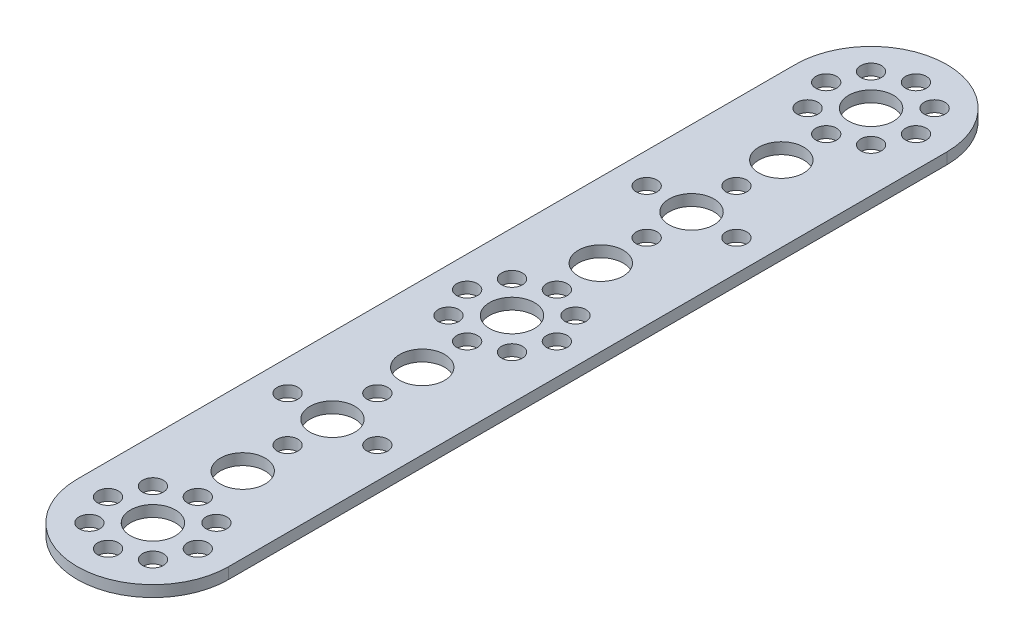
from build123d import *

# Parameters (mm, degrees)
EXTRUDE1_DEPTH = 2
SKETCH2_R      = 4
SKETCH2_R_2    = 1.85
EXTRUDE2_DEPTH = 2


with BuildPart() as part:
    # Sketch1 → Extrude1 (new body)
    with BuildSketch(Plane(origin=(0, 0, 0), x_dir=(1, 0, 0), z_dir=(0, 1, 0))):
        with BuildLine():
            Line((-13.5, 64), (-13.5, -64))
            ThreePointArc((-13.5, -64), (0, -77.5), (13.5, -64))
            Line((13.5, -64), (13.5, 64))
            ThreePointArc((13.5, 64), (0, 77.5), (-13.5, 64))
        make_face()
    extrude(amount=EXTRUDE1_DEPTH)

    # Sketch2 → Extrude2 (cut)
    with BuildSketch(Plane(origin=(0, 2, 0), x_dir=(1, 0, 0), z_dir=(0, 1, 0))):
        with Locations(Location((0, -48, 0), (0, 0, 270))):
            Circle(SKETCH2_R)
        with Locations(Location((0, -16, 0), (0, 0, 270))):
            Circle(SKETCH2_R)
        with Locations(Location((-0.175415159, 16, 0), (0, 0, 270))):
            Circle(SKETCH2_R)
        with Locations(Location((0, 48, 0), (0, 0, 270))):
            Circle(SKETCH2_R)
        with Locations(Location((0, -32, 0), (0, 0, 270))):
            Circle(SKETCH2_R)
        with Locations(Location((0, -24, 0), (0, 0, 270))):
            Circle(SKETCH2_R_2)
        with Locations(Location((0, -40, 0), (0, 0, 270))):
            Circle(SKETCH2_R_2)
        with Locations(Location((8, -32, 0), (0, 0, 270))):
            Circle(SKETCH2_R_2)
        with Locations(Location((-8, -32, 0), (0, 0, 270))):
            Circle(SKETCH2_R_2)
        with Locations(Location((0, -56, 0), (0, 0, 270))):
            Circle(SKETCH2_R_2)
        with Locations(Location((8, -64, 0), (0, 0, 270))):
            Circle(SKETCH2_R_2)
        with Locations(Location((0, -64, 0), (0, 0, 270))):
            Circle(SKETCH2_R)
        with Locations(Location((-8, -64, 0), (0, 0, 270))):
            Circle(SKETCH2_R_2)
        with Locations(Location((-5.66, -69.66, 0), (0, 0, 270))):
            Circle(SKETCH2_R_2)
        with Locations(Location((5.66, -69.66, 0), (0, 0, 270))):
            Circle(SKETCH2_R_2)
        with Locations(Location((0, -72, 0), (0, 0, 270))):
            Circle(SKETCH2_R_2)
        with Locations(Location((-5.66, -58.34, 0), (0, 0, 270))):
            Circle(SKETCH2_R_2)
        with Locations(Location((5.66, -58.34, 0), (0, 0, 270))):
            Circle(SKETCH2_R_2)
        with Locations(Location((0, 32, 0), (0, 0, 270))):
            Circle(SKETCH2_R)
        with Locations(Location((0, 40, 0), (0, 0, 270))):
            Circle(SKETCH2_R_2)
        with Locations(Location((0, 24, 0), (0, 0, 270))):
            Circle(SKETCH2_R_2)
        with Locations(Location((8, 32, 0), (0, 0, 270))):
            Circle(SKETCH2_R_2)
        with Locations(Location((-8, 32, 0), (0, 0, 270))):
            Circle(SKETCH2_R_2)
        with Locations(Location((0, 8, 0), (0, 0, 270))):
            Circle(SKETCH2_R_2)
        with Locations(Location((8, 0, 0), (0, 0, 270))):
            Circle(SKETCH2_R_2)
        with Locations(Location((0, 0, 0), (0, 0, 270))):
            Circle(SKETCH2_R)
        with Locations(Location((-8, 0, 0), (0, 0, 270))):
            Circle(SKETCH2_R_2)
        with Locations(Location((-5.66, -5.66, 0), (0, 0, 270))):
            Circle(SKETCH2_R_2)
        with Locations(Location((5.66, -5.66, 0), (0, 0, 270))):
            Circle(SKETCH2_R_2)
        with Locations(Location((0, -8, 0), (0, 0, 270))):
            Circle(SKETCH2_R_2)
        with Locations(Location((-5.66, 5.66, 0), (0, 0, 270))):
            Circle(SKETCH2_R_2)
        with Locations(Location((5.66, 5.66, 0), (0, 0, 270))):
            Circle(SKETCH2_R_2)
        with Locations(Location((0, 56, 0), (0, 0, 270))):
            Circle(SKETCH2_R_2)
        with Locations(Location((-8, 64, 0), (0, 0, 270))):
            Circle(SKETCH2_R_2)
        with Locations(Location((0, 64, 0), (0, 0, 270))):
            Circle(SKETCH2_R)
        with Locations(Location((8, 64, 0), (0, 0, 270))):
            Circle(SKETCH2_R_2)
        with Locations(Location((5.66, 69.66, 0), (0, 0, 270))):
            Circle(SKETCH2_R_2)
        with Locations(Location((-5.66, 69.66, 0), (0, 0, 270))):
            Circle(SKETCH2_R_2)
        with Locations(Location((0, 72, 0), (0, 0, 270))):
            Circle(SKETCH2_R_2)
        with Locations(Location((5.66, 58.34, 0), (0, 0, 270))):
            Circle(SKETCH2_R_2)
        with Locations(Location((-5.66, 58.34, 0), (0, 0, 270))):
            Circle(SKETCH2_R_2)
    extrude(amount=-EXTRUDE2_DEPTH, mode=Mode.SUBTRACT)


solid = part.part
